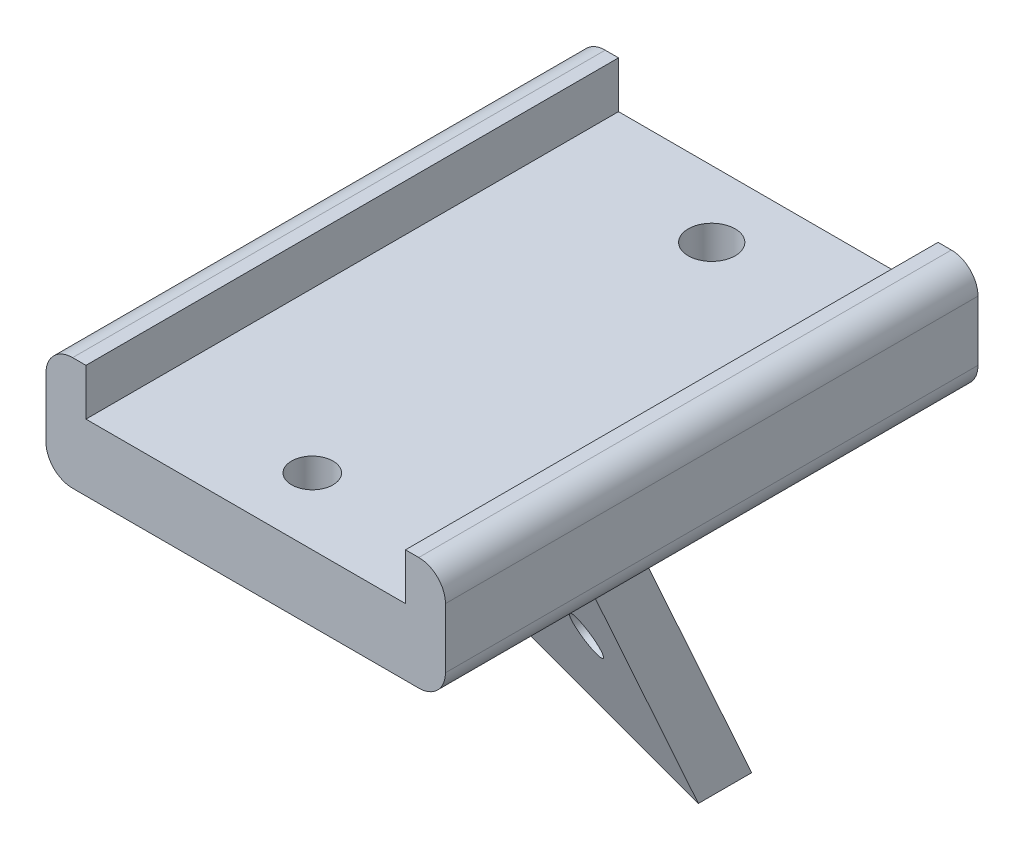
from build123d import *

# Parameters (mm, degrees)
SKETCH1_W           = 22
SKETCH1_H           = 40
SKETCH1_R           = 1.760631049
SKETCH1_R_2         = 1.555398854
BOSS_EXTRUDE1_DEPTH = 5
BOSS_EXTRUDE3_DEPTH = 40
FILLET1_R           = 2
SKETCH6_R           = 1.5
CUT_EXTRUDE1_DEPTH  = 3.543436874


with BuildPart() as part:
    # Sketch1 → Boss-Extrude1 (new body)
    with BuildSketch(Plane(origin=(0, 0, 0), x_dir=(1, 0, 0), z_dir=(0, 1, 0))):
        Rectangle(SKETCH1_W, SKETCH1_H)
        with Locations(Location((0, 15, 0), (0, 0, 270))):
            Circle(SKETCH1_R, mode=Mode.SUBTRACT)
        with Locations(Location((0, -15, 0), (0, 0, 270))):
            Circle(SKETCH1_R_2, mode=Mode.SUBTRACT)
    extrude(amount=BOSS_EXTRUDE1_DEPTH)

    # Sketch4 → Boss-Extrude3 (add)
    with BuildSketch(Plane(origin=(0, 0, -20), x_dir=(-1, 0, 0), z_dir=(0, 0, -1))):
        Polygon((-11, 5), (-12, 5), (-12, 8.5), (-15, 8.5), (-15, 0), (-11, 0), align=None)
        Polygon((11, 0), (11, 5), (12, 5), (12, 8.5), (15, 8.5), (15, 0), align=None)
    extrude(amount=-BOSS_EXTRUDE3_DEPTH)

    # Fillet1
    fillet1_edges = [part.edges().sort_by_distance(p)[0] for p in [
        (15, 0, 0),
        (15, 8.5, 0),
        (-15, 0, 0),
        (-15, 8.5, 0),
    ]]
    fillet(fillet1_edges, radius=FILLET1_R)

    # Sketch2 → Loft1 section 0
    with BuildSketch(Plane.XZ):
        with BuildLine():
            Line((-11, 0.105117767), (11, 6))
            Line((11, 6), (11, 2))
            Line((11, 2), (-11, -3.894882233))
            Line((-11, -3.894882233), (-11, 0.105117767))
        make_face()
    # Sketch5 → Loft1 section 1
    with BuildSketch(Plane(origin=(0, -20, 0), x_dir=(-1, 0, 0), z_dir=(0, -1, 0))):
        with BuildLine():
            Line((-11, 3), (-11, 7))
            Line((-11, 7), (11, 12.894882233))
            Line((11, 12.894882233), (11, 8.894882233))
            Line((11, 8.894882233), (-11, 3))
        make_face()
    loft()

    # Sketch6 → Cut-Extrude1 (cut)
    with BuildSketch(Plane(origin=(0.199220533, 0.334575519, -0.743501152), x_dir=(0.9714204714250083, -0.0974063192292946, 0.21645848717621446), z_dir=(-0.23736526219397533, -0.3986366483069058, 0.885859218459808))):
        with Locations(Location((6.11854216, -9.770227238, 0), (0, 0, 90))):
            Circle(SKETCH6_R)
        with Locations(Location((-6.528705502, -11.121135003, 0), (0, 0, 90))):
            Circle(SKETCH6_R)
    extrude(amount=CUT_EXTRUDE1_DEPTH, mode=Mode.SUBTRACT)


solid = part.part
